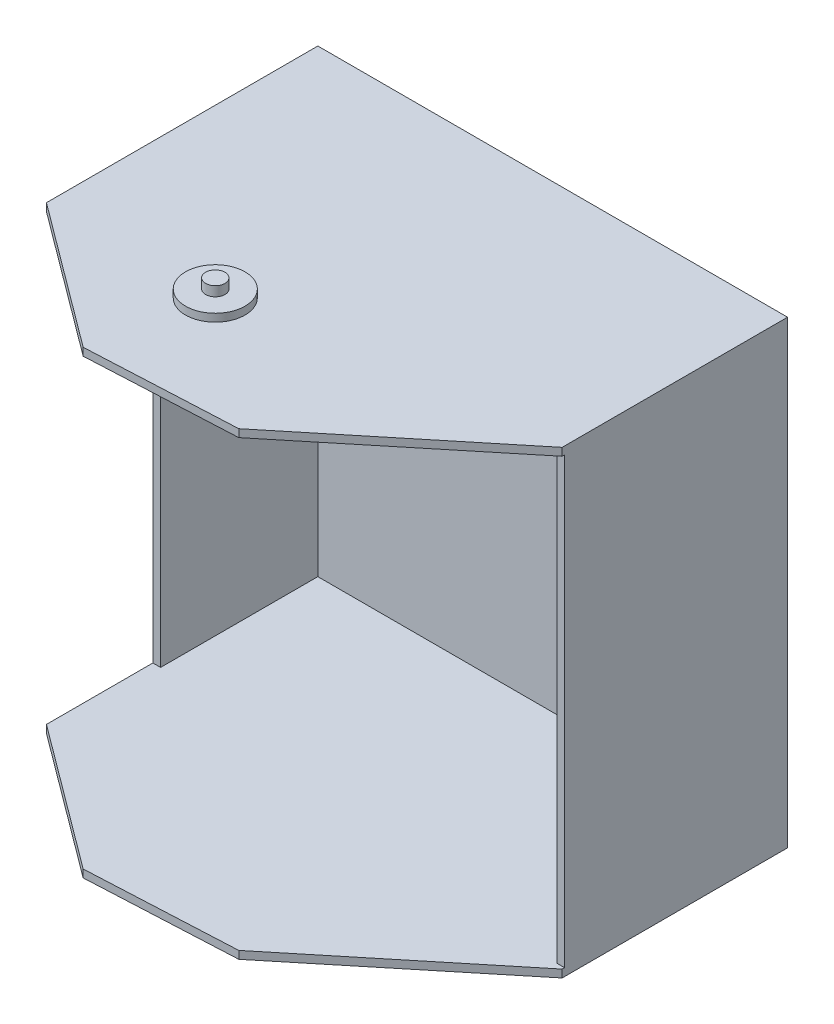
from build123d import *

# Parameters (mm, degrees)
BOSS_EXTRUDE1_DEPTH = 3.2
SKETCH3_R           = 12.3
BOSS_EXTRUDE2_DEPTH = 3.2
SKETCH4_R           = 4
BOSS_EXTRUDE3_DEPTH = 4
SKETCH6_W           = 3.2
SKETCH6_H           = 65
BOSS_EXTRUDE4_DEPTH = 190
SKETCH8_W           = 3.2
SKETCH8_H           = 89
BOSS_EXTRUDE5_DEPTH = 190
SKETCH9_W           = 194.2
SKETCH9_H           = 190
BOSS_EXTRUDE7_DEPTH = 3.2


with BuildPart() as part:
    # Sketch1 → Boss-Extrude1 (new body)
    with BuildSketch(Plane(origin=(0, 0, 0), x_dir=(1, 0, 0), z_dir=(0, 1, 0))):
        Polygon((-71.199297972, 0), (119.800702028, 0), (119.800702028, -90), (46.272924854, -150.155348756), (-15.035731115, -153.181069815), (-74.399297972, -109), (-74.399297972, -65), (-71.199297972, -65), align=None)
    boss_extrude1 = extrude(amount=BOSS_EXTRUDE1_DEPTH)

    # Sketch3 → Boss-Extrude2 (add)
    with BuildSketch(Plane.XZ):
        with Locations(Location((-5.399297972, 108.199281837, 0), (0, 0, 270))):
            Circle(SKETCH3_R)
    boss_extrude2 = extrude(amount=BOSS_EXTRUDE2_DEPTH)

    # Sketch4 → Boss-Extrude3 (add)
    with BuildSketch(Plane.XZ.offset(3.2)):
        with Locations(Location((-5.399297972, 108.199281837, 0), (0, 0, 270))):
            Circle(SKETCH4_R)
    boss_extrude3 = extrude(amount=BOSS_EXTRUDE3_DEPTH)

    # Sketch6 → Boss-Extrude4 (add)
    with BuildSketch(Plane(origin=(0, 0, 0), x_dir=(1, 0, 0), z_dir=(0, 1, 0))):
        with Locations((-72.799297972, -32.5)):
            Rectangle(SKETCH6_W, SKETCH6_H)
    extrude(amount=BOSS_EXTRUDE4_DEPTH)

    # Sketch8 → Boss-Extrude5 (add)
    with BuildSketch(Plane(origin=(0, 0, 0), x_dir=(1, 0, 0), z_dir=(0, 1, 0))):
        with Locations((118.200702028, -44.5)):
            Rectangle(SKETCH8_W, SKETCH8_H)
    extrude(amount=BOSS_EXTRUDE5_DEPTH)

    # Mirror1: Boss-Extrude1, Boss-Extrude2, Boss-Extrude3 across plane
    add(boss_extrude1.mirror(Plane(origin=(0, 95, 0), x_dir=(0, 0, 1), z_dir=(0, -1, 0))))
    add(boss_extrude2.mirror(Plane(origin=(0, 95, 0), x_dir=(0, 0, 1), z_dir=(0, -1, 0))))
    add(boss_extrude3.mirror(Plane(origin=(0, 95, 0), x_dir=(0, 0, 1), z_dir=(0, -1, 0))))

    # Sketch9 → Boss-Extrude7 (add)
    with BuildSketch(Plane.XY):
        with Locations((22.700702028, 95)):
            Rectangle(SKETCH9_W, SKETCH9_H)
    extrude(amount=-BOSS_EXTRUDE7_DEPTH)


solid = part.part
